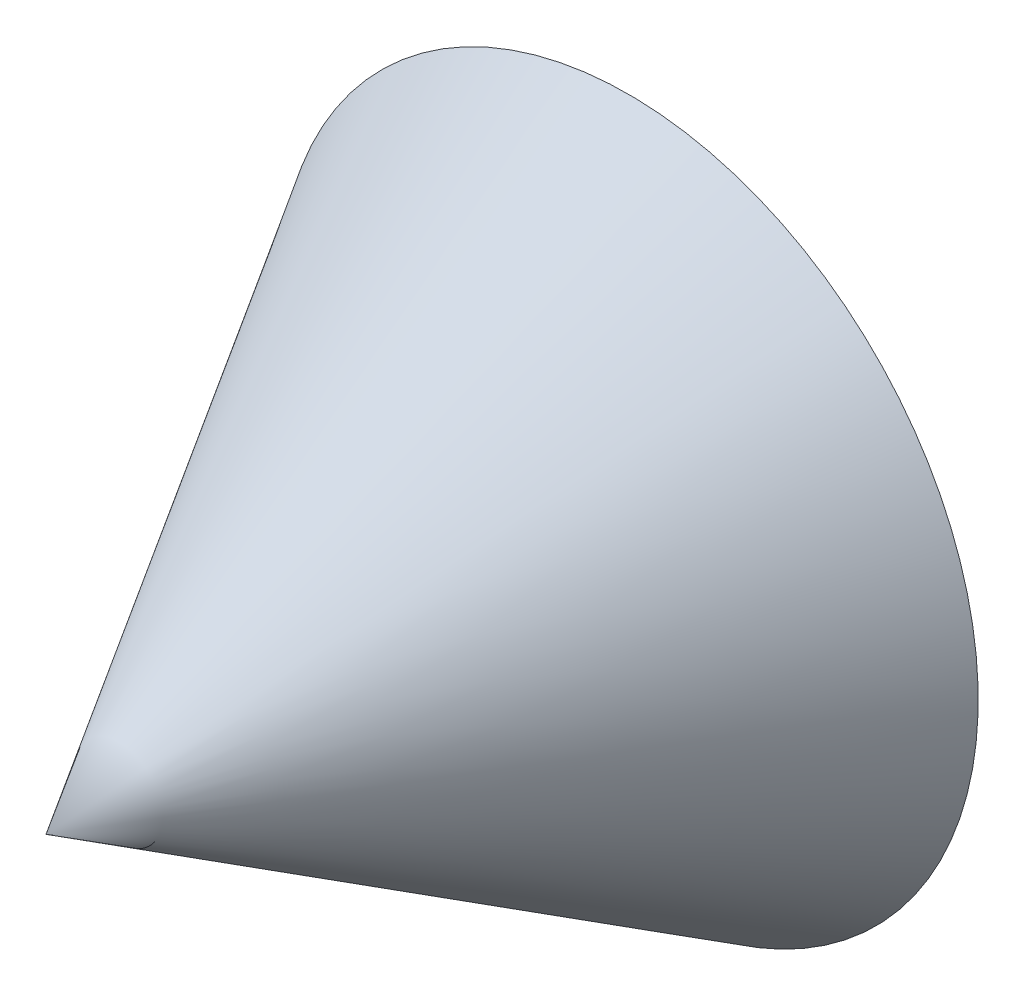
from build123d import *


with BuildPart() as part:
    # sketch:profile → feature:turn (revolve)
    with BuildSketch(Plane.XZ, mode=Mode.PRIVATE) as feature_turn_sk:
        Polygon((0, 0), (6, 0), (0, 10), align=None)
    revolve(feature_turn_sk.sketch.rotate(Axis((0, 0, -10), (0, 0, 1)), 180), axis=Axis((0, 0, -10), (0, 0, 1)))


solid = part.part
